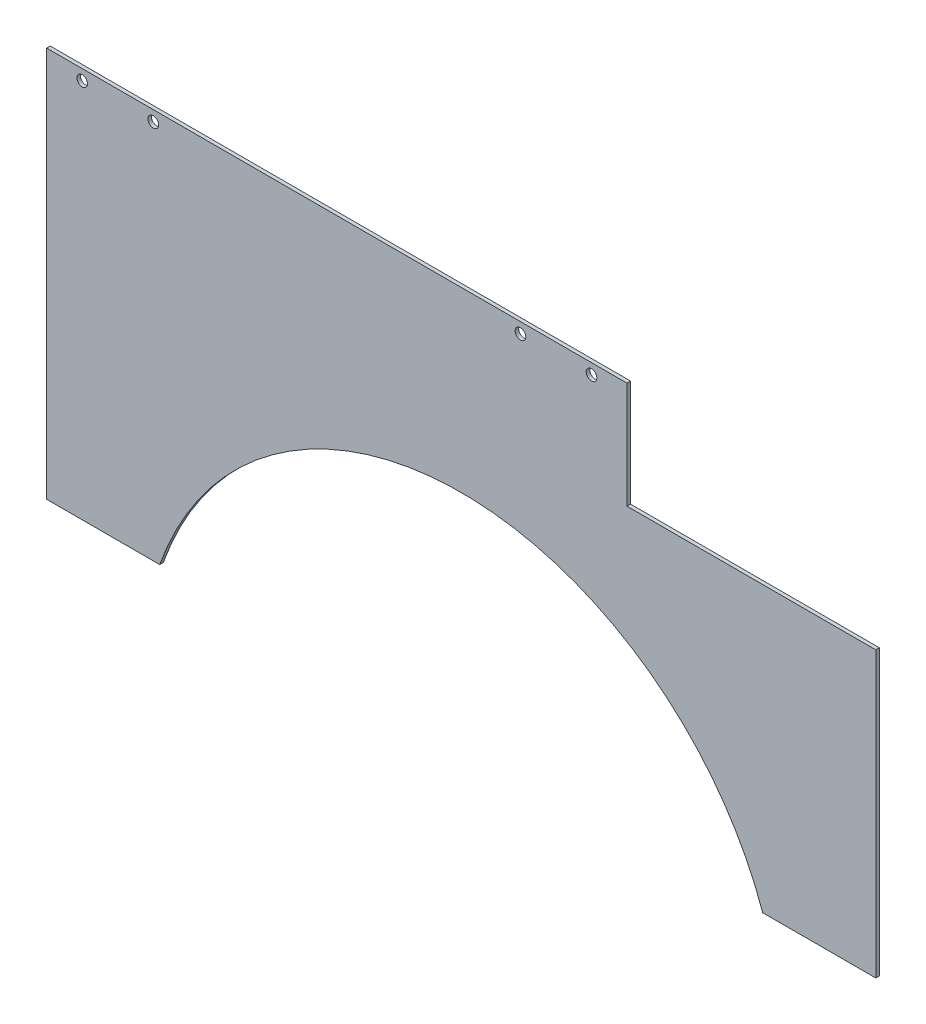
from build123d import *

# Parameters (mm, degrees)
SKETCH_1_W          = 233.345237792
SKETCH_1_H          = 110
SKETCH_1_R          = 1.5
EXTRUDE_1_DEPTH     = 1
SKETCH_2_W          = 70
SKETCH_2_H          = 30
CUT_EXTRUDE_1_DEPTH = 258.974804971
SKETCH_3_R          = 1.5
CUT_EXTRUDE_2_DEPTH = 258.974804971
SKETCH_4_R          = 90
CUT_EXTRUDE_3_DEPTH = 258.974804971


with BuildPart() as part:
    # 草图1 → 凸台-拉伸1 (new body)
    with BuildSketch(Plane.XY):
        with Locations((116.672618896, 55)):
            Rectangle(SKETCH_1_W, SKETCH_1_H)
        with Locations((10, 107)):
            Circle(SKETCH_1_R, mode=Mode.SUBTRACT)
        with Locations((30, 107)):
            Circle(SKETCH_1_R, mode=Mode.SUBTRACT)
        with Locations(Location((203.345237792, 107, 0), (0, 0, 180))):
            Circle(SKETCH_1_R, mode=Mode.SUBTRACT)
        with Locations(Location((223.345237792, 107, 0), (0, 0, 180))):
            Circle(SKETCH_1_R, mode=Mode.SUBTRACT)
    extrude(amount=EXTRUDE_1_DEPTH)

    # 草图2 → 切除-拉伸1 (cut, through all)
    with BuildSketch(Plane.XY.offset(1)):
        with Locations((198.345237792, 95)):
            Rectangle(SKETCH_2_W, SKETCH_2_H)
    extrude(amount=-CUT_EXTRUDE_1_DEPTH, mode=Mode.SUBTRACT)

    # 草图3 → 切除-拉伸2 (cut, through all)
    with BuildSketch(Plane.XY.offset(1)):
        with Locations((10, 107)):
            Circle(SKETCH_3_R)
        with Locations((30, 107)):
            Circle(SKETCH_3_R)
        with Locations(Location((133.345237792, 107, 0), (0, 0, 180))):
            Circle(SKETCH_3_R)
        with Locations(Location((153.345237792, 107, 0), (0, 0, 180))):
            Circle(SKETCH_3_R)
    extrude(amount=-CUT_EXTRUDE_2_DEPTH, mode=Mode.SUBTRACT)

    # 草图4 → 切除-拉伸3 (cut, through all)
    with BuildSketch(Plane.XY.offset(1)):
        with Locations((116.672618896, -30)):
            Circle(SKETCH_4_R)
    extrude(amount=-CUT_EXTRUDE_3_DEPTH, mode=Mode.SUBTRACT)


solid = part.part
